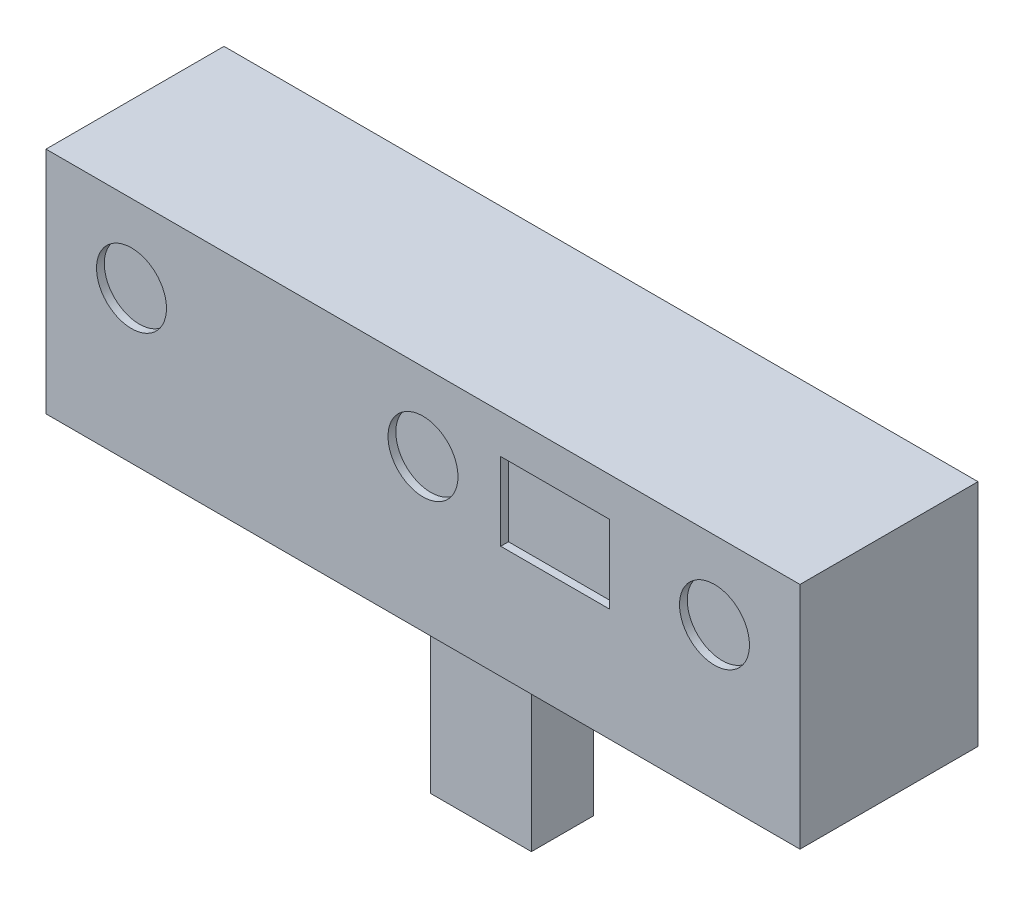
from build123d import *

# Parameters (mm, degrees)
SK_BODY_W              = 97
SK_BODY_H              = 29.5
EX_BODY_DEPTH          = 22.9
SK_VESA_2XM4_R         = 1.65
CUT_VESA_2XM4_DEPTH    = 8
SK_LENSES_R            = 4.5
SK_LENSES_W            = 14
SK_LENSES_H            = 10
CUT_LENSES_DEPTH       = 1
SK_KEEPOUT_USB_C_W     = 13
SK_KEEPOUT_USB_C_H     = 8
EX_KEEPOUT_USB_C_DEPTH = 25


with BuildPart() as part:
    # SK_Body → EX_Body (new body)
    with BuildSketch(Plane.XY):
        with Locations((0, -4.75)):
            Rectangle(SK_BODY_W, SK_BODY_H)
    extrude(amount=EX_BODY_DEPTH)

    # SK_VESA_2xM4 → CUT_VESA_2xM4 (cut)
    with BuildSketch(Plane.XY):
        with Locations((37.5, -4.75)):
            Circle(SK_VESA_2XM4_R)
        with Locations((-37.5, -4.75)):
            Circle(SK_VESA_2XM4_R)
    extrude(amount=CUT_VESA_2XM4_DEPTH, mode=Mode.SUBTRACT)

    # SK_Lenses → CUT_Lenses (cut)
    with BuildSketch(Plane.XY.offset(22.9)):
        with Locations((37.5, 0)):
            Circle(SK_LENSES_R)
        with Locations((-37.5, 0)):
            Circle(SK_LENSES_R)
        Circle(SK_LENSES_R)
        with Locations((17, 0)):
            Rectangle(SK_LENSES_W, SK_LENSES_H)
    extrude(amount=-CUT_LENSES_DEPTH, mode=Mode.SUBTRACT)

    # SK_KeepOut_USB_C → EX_KeepOut_USB_C (add)
    with BuildSketch(Plane(origin=(0, -19.5, 0), x_dir=(1, 0, 0), z_dir=(0, 1, 0))):
        with Locations((0, -11.45)):
            Rectangle(SK_KEEPOUT_USB_C_W, SK_KEEPOUT_USB_C_H)
    extrude(amount=-EX_KEEPOUT_USB_C_DEPTH)


solid = part.part
